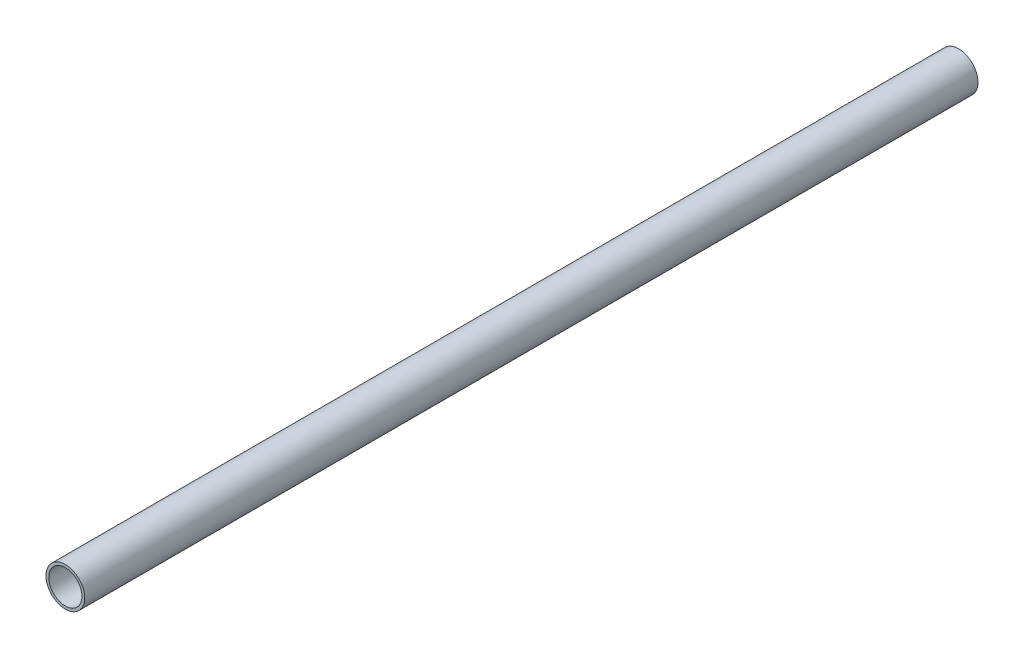
from build123d import *

# Parameters (mm, degrees)
SKETCH1_R           = 11.1125
SKETCH1_R_2         = 9.525
BOSS_EXTRUDE1_DEPTH = 256.2352


with BuildPart() as part:
    # Sketch1 → Boss-Extrude1 (new, symmetric)
    with BuildSketch(Plane.XY):
        Circle(SKETCH1_R)
        Circle(SKETCH1_R_2, mode=Mode.SUBTRACT)
    extrude(amount=BOSS_EXTRUDE1_DEPTH, both=True)


solid = part.part
